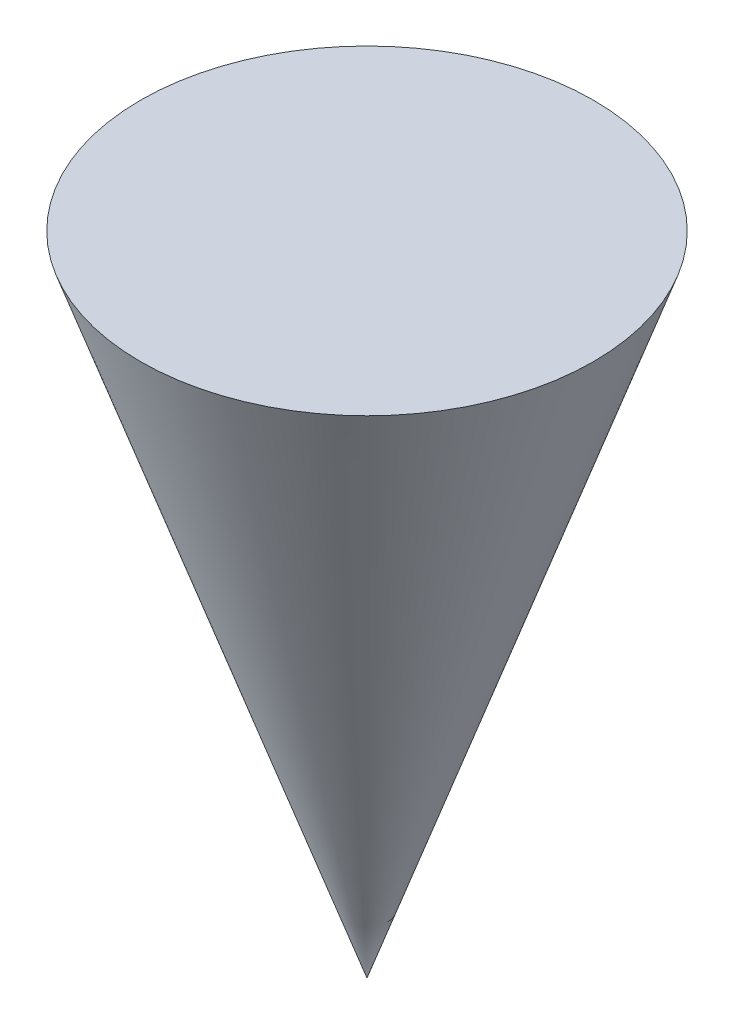
from build123d import *


with BuildPart() as part:
    # Sketch1 → Revolve1 (revolve)
    with BuildSketch(Plane.XY, mode=Mode.PRIVATE) as revolve1_sk:
        Polygon((0, 0), (0, 20), (7, 20), align=None)
    revolve(revolve1_sk.sketch.rotate(Axis((0, 0, 0), (0, 1, 0)), 270), axis=Axis((0, 0, 0), (0, 1, 0)))


solid = part.part
